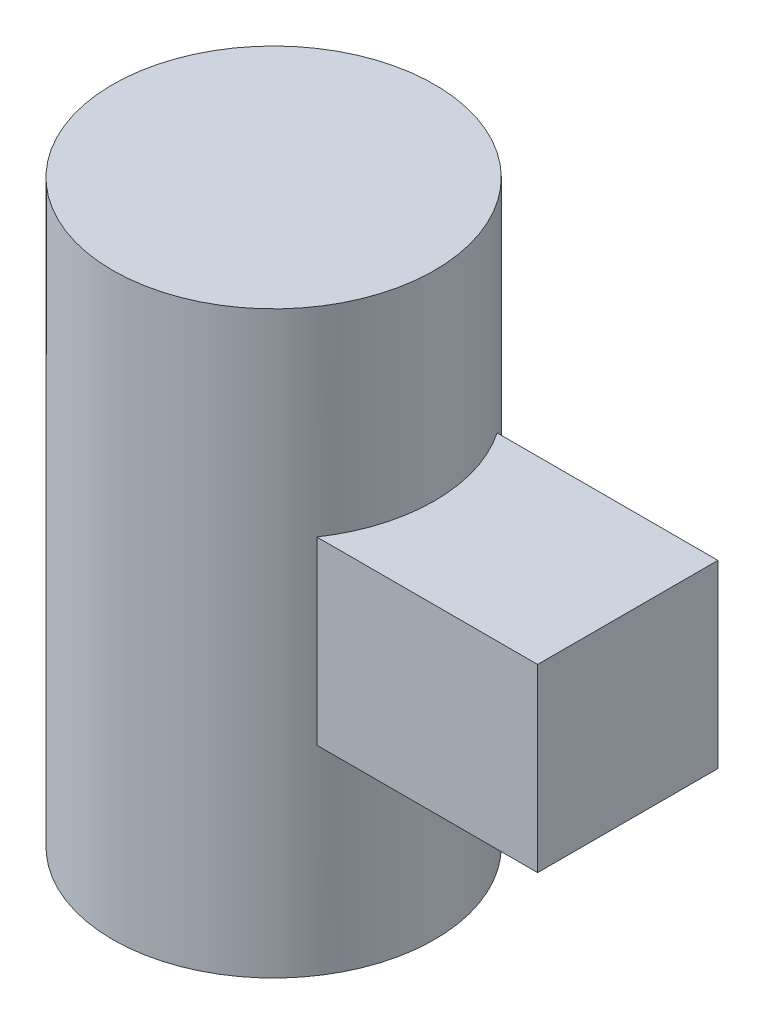
from build123d import *

# Parameters (mm, degrees)
SKETCH1_R           = 31.75
BOSS_EXTRUDE1_DEPTH = 57.15
SKETCH2_W           = 35.56
SKETCH2_H           = 35.56
BOSS_EXTRUDE2_DEPTH = 69.85


with BuildPart() as part:
    # Sketch1 → Boss-Extrude1 (new, symmetric)
    with BuildSketch(Plane(origin=(0, 0, 0), x_dir=(1, 0, 0), z_dir=(0, 1, 0))):
        with Locations(Location((0, 0, 0), (0, 0, 270))):
            Circle(SKETCH1_R)
    extrude(amount=BOSS_EXTRUDE1_DEPTH, both=True)

    # Sketch2 → Boss-Extrude2 (add)
    with BuildSketch(Plane(origin=(0, 0, 0), x_dir=(0, 0, -1), z_dir=(1, 0, 0))):
        Rectangle(SKETCH2_W, SKETCH2_H)
    extrude(amount=BOSS_EXTRUDE2_DEPTH)


solid = part.part
